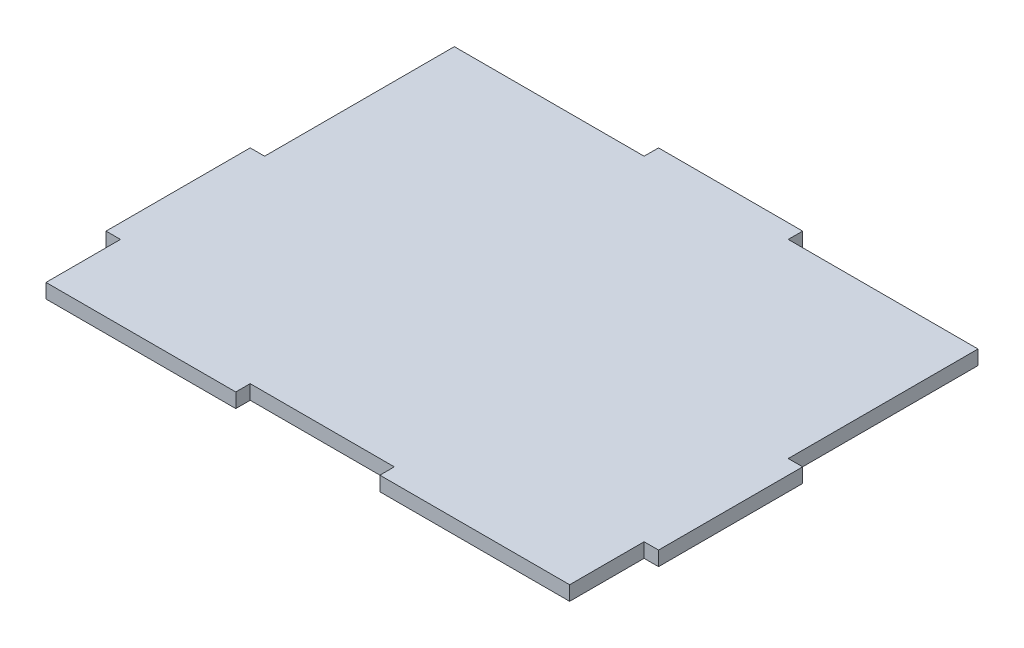
from build123d import *

# Parameters (mm, degrees)
SKETCH1_W           = 30
SKETCH1_H           = 3
SKETCH1_W_2         = 3
SKETCH1_H_2         = 30
BOSS_EXTRUDE1_DEPTH = 3
CUT_EXTRUDE1_DEPTH  = 10


with BuildPart() as part:
    # Sketch1 → Boss-Extrude1 (new body)
    with BuildSketch(Plane(origin=(0, 0, 0), x_dir=(1, 0, 0), z_dir=(0, 1, 0))):
        with Locations((0, -56)):
            Rectangle(SKETCH1_W, SKETCH1_H)
        with Locations((-56, 0)):
            Rectangle(SKETCH1_W_2, SKETCH1_H_2)
        with Locations((0, 56)):
            Rectangle(SKETCH1_W, SKETCH1_H)
        Polygon((-54.5, -54.5), (-54.5, -15), (-54.5, 15), (-54.5, 54.5), (-15, 54.5), (15, 54.5), (54.5, 54.5), (54.5, 15), (54.5, -15), (54.5, -54.5), (15, -54.5), (-15, -54.5), align=None)
        with Locations((56, 0)):
            Rectangle(SKETCH1_W_2, SKETCH1_H_2)
    extrude(amount=BOSS_EXTRUDE1_DEPTH)

    # Sketch2 → Cut-Extrude1 (cut)
    with BuildSketch(Plane(origin=(0, 3, 0), x_dir=(1, 0, 0), z_dir=(0, 1, 0))):
        Polygon((-15, -30.5), (-15, -27.5), (15, -27.5), (15, -30.499716912), (54.5, -30.499716912), (54.5, -57.5), (-54.5, -57.5), (-54.5, -30.5), align=None)
    extrude(amount=-CUT_EXTRUDE1_DEPTH, mode=Mode.SUBTRACT)


solid = part.part
